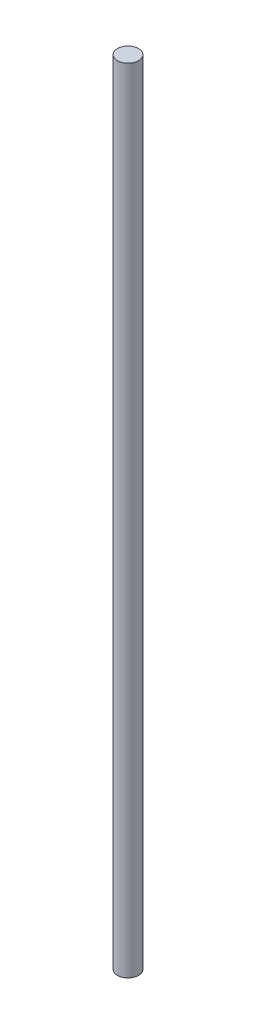
from build123d import *

# Parameters (mm, degrees)
SKETCH_1_R      = 2
EXTRUDE_1_DEPTH = 150


with BuildPart() as part:
    # 草图1 → 凸台-拉伸1 (new body)
    with BuildSketch(Plane(origin=(0, 0, 0), x_dir=(1, 0, 0), z_dir=(0, 1, 0))):
        with Locations(Location((0, 0, 0), (0, 0, 270))):
            Circle(SKETCH_1_R)
    extrude(amount=EXTRUDE_1_DEPTH)


solid = part.part
